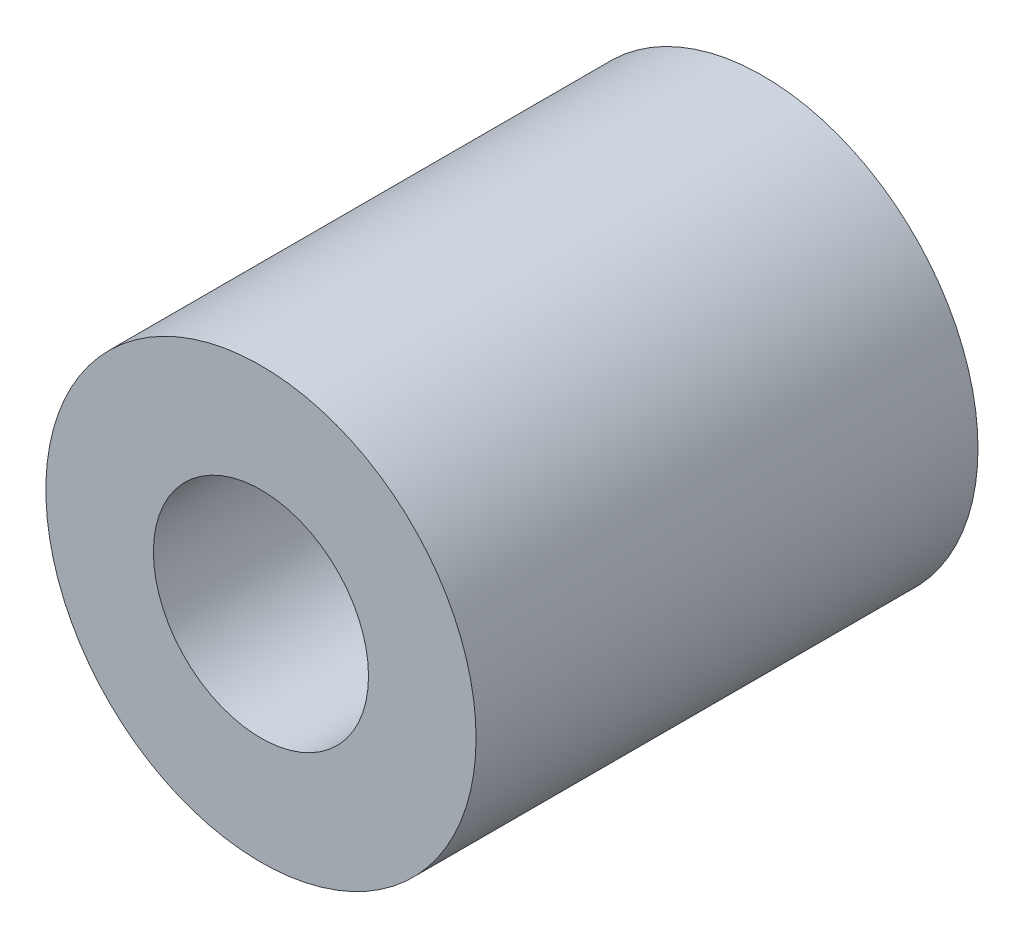
from build123d import *

# Parameters (mm, degrees)
SKETCH2_R           = 3
BOSS_EXTRUDE1_DEPTH = 7
SKETCH3_R           = 1.5
CUT_EXTRUDE1_DEPTH  = 9.185352772


with BuildPart() as part:
    # Sketch2 → Boss-Extrude1 (new body)
    with BuildSketch(Plane.XY):
        Circle(SKETCH2_R)
    extrude(amount=BOSS_EXTRUDE1_DEPTH)

    # Sketch3 → Cut-Extrude1 (cut, through all)
    with BuildSketch(Plane.XY.offset(7)):
        Circle(SKETCH3_R)
    extrude(amount=-CUT_EXTRUDE1_DEPTH, mode=Mode.SUBTRACT)


solid = part.part
